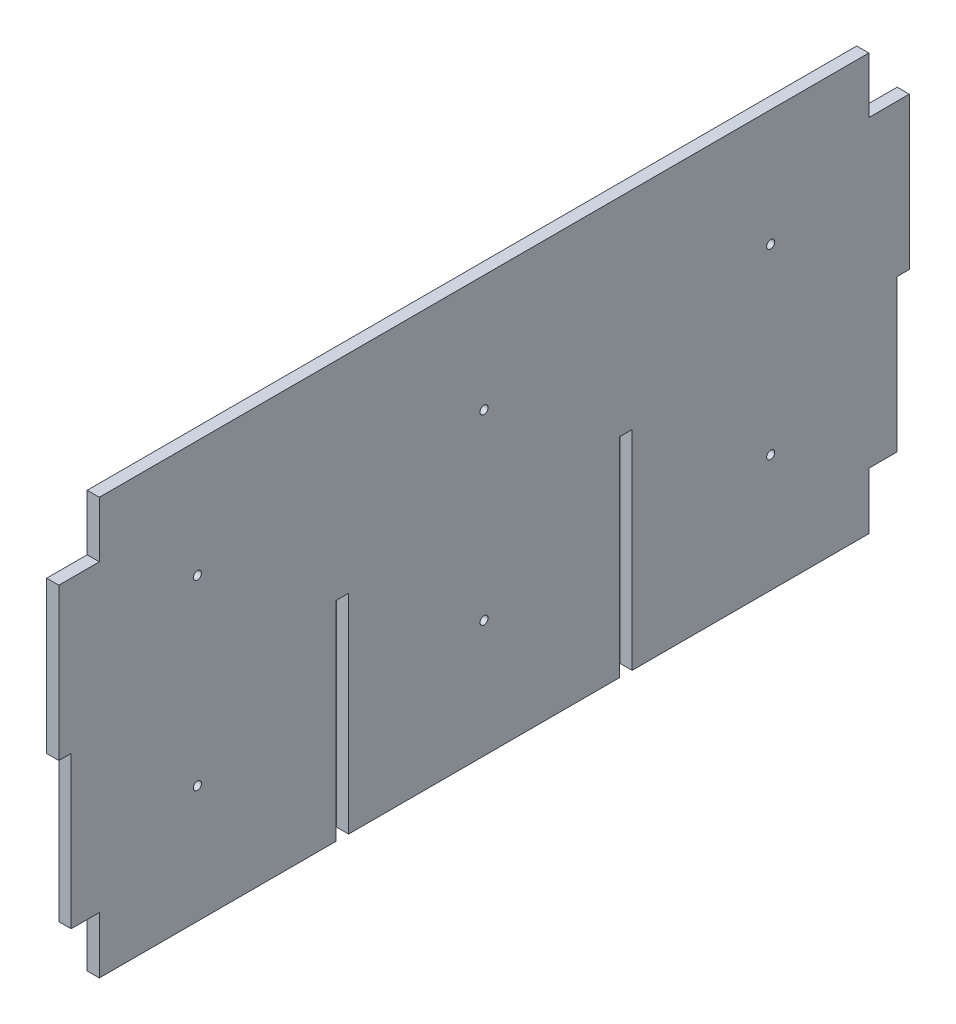
from build123d import *

# Parameters (mm, degrees)
SKETCH3_W           = 420
SKETCH3_H           = 170
BOSS_EXTRUDE2_DEPTH = 6
SKETCH4_W           = 6.1
SKETCH4_H           = 85
SKETCH4_W_2         = 6.2
CUT_EXTRUDE1_DEPTH  = 6
SKETCH5_R           = 2
CUT_EXTRUDE2_DEPTH  = 6
SKETCH6_W           = 6
SKETCH6_H           = 380
BOSS_EXTRUDE3_DEPTH = 30
SKETCH7_W           = 6
SKETCH7_H           = 380
CUT_EXTRUDE3_DEPTH  = 2
SKETCH8_W           = 6
SKETCH8_H           = 116.9
SKETCH8_H_2         = 133.8
BOSS_EXTRUDE4_DEPTH = 28
SKETCH9_W           = 6
SKETCH9_H           = 6.2
BOSS_EXTRUDE5_DEPTH = 113
SKETCH10_W          = 6
SKETCH10_H          = 6.2
BOSS_EXTRUDE6_DEPTH = 113
SKETCH11_W          = 6.2
SKETCH11_H          = 113
CUT_EXTRUDE4_DEPTH  = 113
SKETCH12_W          = 6
SKETCH12_H          = 10
CUT_EXTRUDE6_DEPTH  = 1000
SKETCH13_W          = 20
SKETCH13_H          = 10
SKETCH13_W_2        = 13.9
CUT_EXTRUDE7_DEPTH  = 1000


with BuildPart() as part:
    # Sketch3 → Boss-Extrude2 (new body)
    with BuildSketch(Plane(origin=(0, 0, 0), x_dir=(0, 0, -1), z_dir=(1, 0, 0))):
        with Locations((440.911700258, 161.915861829)):
            Rectangle(SKETCH3_W, SKETCH3_H)
    extrude(amount=BOSS_EXTRUDE2_DEPTH)

    # Sketch4 → Cut-Extrude1 (cut)
    with BuildSketch(Plane(origin=(6, 0, 0), x_dir=(0, 0, -1), z_dir=(1, 0, 0))):
        with Locations((233.961700258, 119.415861829)):
            Rectangle(SKETCH4_W, SKETCH4_H)
        with Locations((647.861700258, 119.415861829)):
            Rectangle(SKETCH4_W, SKETCH4_H)
        with Locations((370.911700258, 204.415861829)):
            Rectangle(SKETCH4_W_2, SKETCH4_H)
        with Locations((510.911700258, 204.415861829)):
            Rectangle(SKETCH4_W_2, SKETCH4_H)
    extrude(amount=-CUT_EXTRUDE1_DEPTH, mode=Mode.SUBTRACT)

    # Sketch5 → Cut-Extrude2 (cut)
    with BuildSketch(Plane(origin=(6, 0, 0), x_dir=(0, 0, -1), z_dir=(1, 0, 0))):
        with Locations((299.361700258, 206.915861829)):
            Circle(SKETCH5_R)
        with Locations((299.361700258, 116.915861829)):
            Circle(SKETCH5_R)
        with Locations((440.911700258, 206.915861829)):
            Circle(SKETCH5_R)
        with Locations((582.461700258, 206.915861829)):
            Circle(SKETCH5_R)
        with Locations((582.461700258, 116.915861829)):
            Circle(SKETCH5_R)
        with Locations((440.911700258, 116.915861829)):
            Circle(SKETCH5_R)
    extrude(amount=-CUT_EXTRUDE2_DEPTH, mode=Mode.SUBTRACT)

    # Sketch6 → Boss-Extrude3 (add)
    with BuildSketch(Plane.XZ.offset(-76.915861829)):
        with Locations((3, -440.911700258)):
            Rectangle(SKETCH6_W, SKETCH6_H)
    extrude(amount=BOSS_EXTRUDE3_DEPTH)

    # Sketch7 → Cut-Extrude3 (cut)
    with BuildSketch(Plane.XZ.offset(-46.915861829)):
        with Locations((3, -440.911700258)):
            Rectangle(SKETCH7_W, SKETCH7_H)
    extrude(amount=-CUT_EXTRUDE3_DEPTH, mode=Mode.SUBTRACT)

    # Sketch8 → Boss-Extrude4 (add)
    with BuildSketch(Plane(origin=(0, 246.915861829, 0), x_dir=(1, 0, 0), z_dir=(0, 1, 0))):
        with Locations((3, 309.361700258)):
            Rectangle(SKETCH8_W, SKETCH8_H)
        with Locations((3, 572.461700258)):
            Rectangle(SKETCH8_W, SKETCH8_H)
        with Locations((3, 440.911700258)):
            Rectangle(SKETCH8_W, SKETCH8_H_2)
    extrude(amount=BOSS_EXTRUDE4_DEPTH)

    # Sketch9 → Boss-Extrude5 (add)
    with BuildSketch(Plane(origin=(0, 161.915861829, 0), x_dir=(1, 0, 0), z_dir=(0, 1, 0))):
        with Locations((3, 370.911700258)):
            Rectangle(SKETCH9_W, SKETCH9_H)
    extrude(amount=BOSS_EXTRUDE5_DEPTH)

    # Sketch10 → Boss-Extrude6 (add)
    with BuildSketch(Plane(origin=(0, 161.915861829, 0), x_dir=(1, 0, 0), z_dir=(0, 1, 0))):
        with Locations((3, 510.911700258)):
            Rectangle(SKETCH10_W, SKETCH10_H)
    extrude(amount=BOSS_EXTRUDE6_DEPTH)

    # Sketch11 → Cut-Extrude4 (cut)
    with BuildSketch(Plane(origin=(6, 0, 0), x_dir=(0, 0, -1), z_dir=(1, 0, 0))):
        with Locations((370.911700258, 105.415861829)):
            Rectangle(SKETCH11_W, SKETCH11_H)
        with Locations((510.911700258, 105.415861829)):
            Rectangle(SKETCH11_W, SKETCH11_H)
    extrude(amount=-CUT_EXTRUDE4_DEPTH, mode=Mode.SUBTRACT)

    # Sketch12 → Cut-Extrude6 (cut)
    with BuildSketch(Plane.XY.offset(-250.911700258)):
        with Locations((3, 269.515338883)):
            Rectangle(SKETCH12_W, SKETCH12_H)
        with Locations((3, 53.915861829)):
            Rectangle(SKETCH12_W, SKETCH12_H)
    extrude(amount=-CUT_EXTRUDE6_DEPTH, mode=Mode.SUBTRACT)


with BuildPart() as body_2:
    # of the pieces the cut leaves, the one that is kept (cut_extrude6_keep)
    add(part.part.solids().sort_by_distance((0, 76.915861829, -237.011700258))[0])

    # Sketch13 → Cut-Extrude7 (cut)
    with BuildSketch(Plane(origin=(6, 0, 0), x_dir=(0, 0, -1), z_dir=(1, 0, 0))):
        with Locations((240.911700258, 241.915861829)):
            Rectangle(SKETCH13_W, SKETCH13_H)
        with Locations((640.911700258, 241.915861829)):
            Rectangle(SKETCH13_W, SKETCH13_H)
        with Locations((243.961700258, 81.915861829)):
            Rectangle(SKETCH13_W_2, SKETCH13_H)
        with Locations((637.861700258, 81.915861829)):
            Rectangle(SKETCH13_W_2, SKETCH13_H)
    extrude(amount=-CUT_EXTRUDE7_DEPTH, mode=Mode.SUBTRACT)


solid = body_2.part
